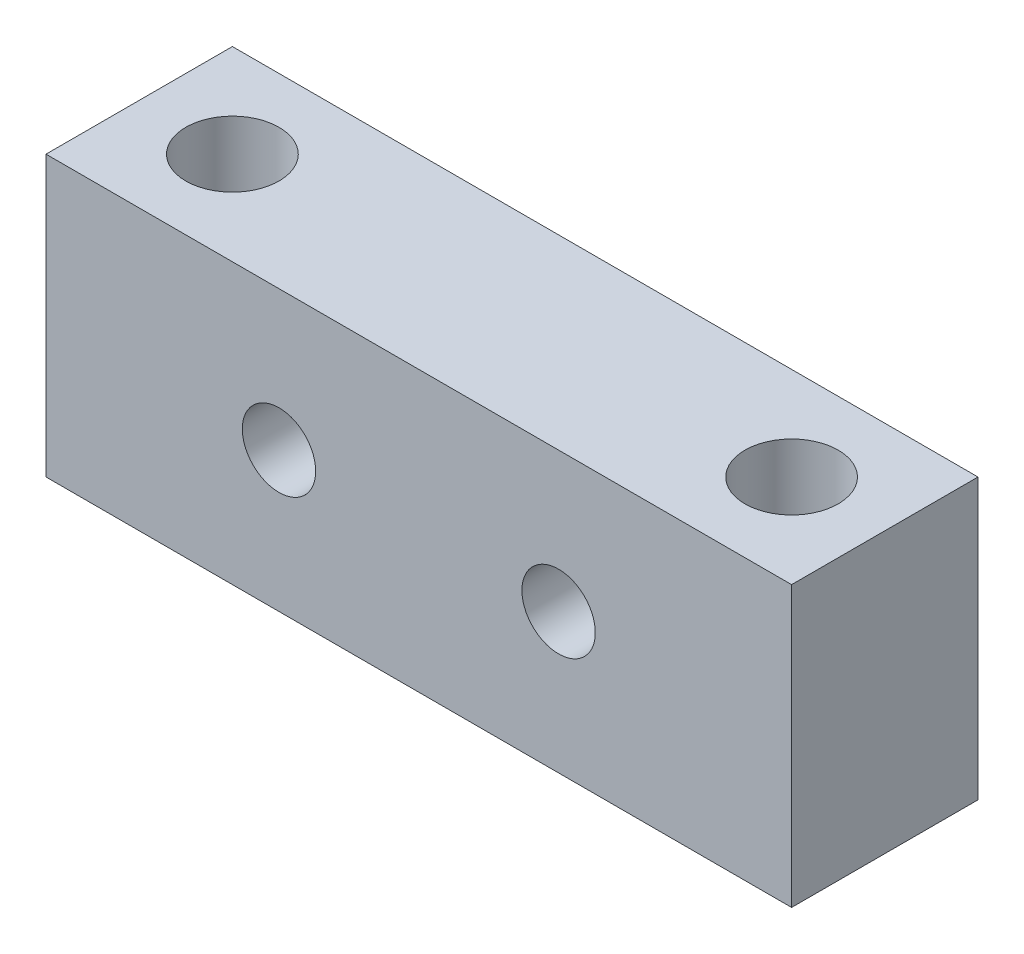
from build123d import *

# Parameters (mm, degrees)
SKETCH1_W           = 50.8
SKETCH1_H           = 19.05
BOSS_EXTRUDE1_DEPTH = 12.7
SKETCH2_R           = 2.5
CUT_EXTRUDE1_DEPTH  = 30.952890094
SKETCH3_R           = 3.175
CUT_EXTRUDE2_DEPTH  = 35.195796525


with BuildPart() as part:
    # Sketch1 → Boss-Extrude1 (new body)
    with BuildSketch(Plane.XY):
        Rectangle(SKETCH1_W, SKETCH1_H)
    extrude(amount=BOSS_EXTRUDE1_DEPTH)

    # Sketch2 → Cut-Extrude1 (cut, through all)
    with BuildSketch(Plane.XY.offset(12.7)):
        with Locations((-9.525, 0)):
            Circle(SKETCH2_R)
        with Locations(Location((9.525, 0, 0), (0, 0, 180))):
            Circle(SKETCH2_R)
    extrude(amount=-CUT_EXTRUDE1_DEPTH, mode=Mode.SUBTRACT)

    # Sketch3 → Cut-Extrude2 (cut, through all)
    with BuildSketch(Plane(origin=(0, 9.525, 0), x_dir=(1, 0, 0), z_dir=(0, 1, 0))):
        with Locations(Location((-19.05, -6.35, 0), (0, 0, 270))):
            Circle(SKETCH3_R)
        with Locations(Location((19.05, -6.35, 0), (0, 0, 270))):
            Circle(SKETCH3_R)
    extrude(amount=-CUT_EXTRUDE2_DEPTH, mode=Mode.SUBTRACT)


solid = part.part
